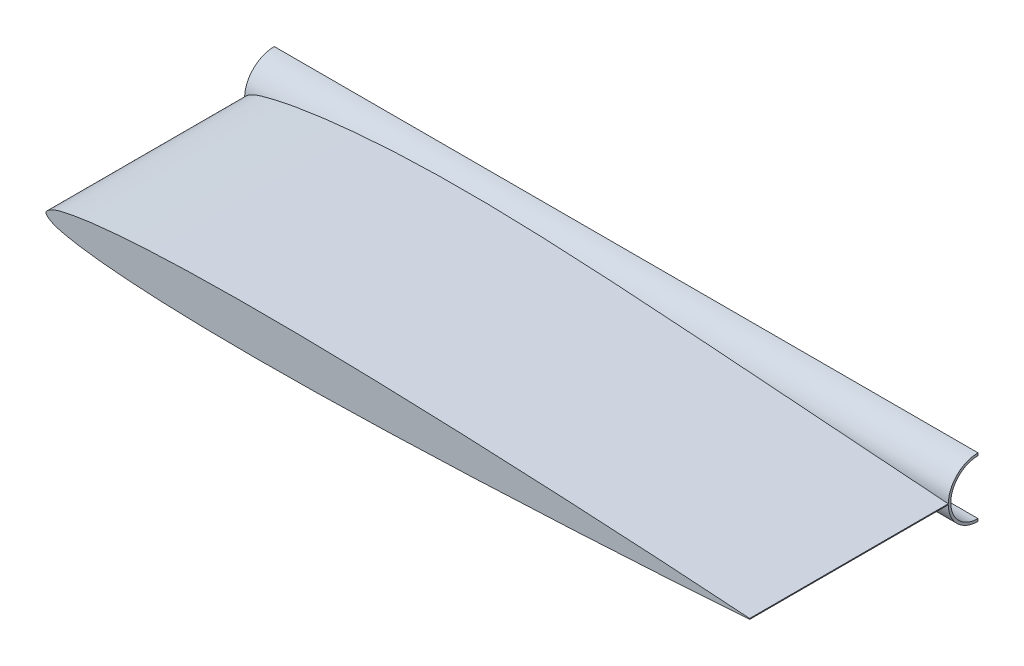
from build123d import *

# Parameters (mm, degrees)
BOSS_EXTRUDE1_DEPTH     = 185.42
BOSS_EXTRUDE2_DEPTH     = 571.5
CUT_EXTRUDE1_DEPTH      = 602.31113698
CUT_EXTRUDE1_DEPTH_BACK = 602.31113698


with BuildPart() as part:
    # Sketch1 → Boss-Extrude1 (new body)
    with BuildSketch(Plane.XY):
        with BuildLine():
            Line((571.5, 0.360045), (571.5, -0.360045))
            add(Edge.make_bspline(
                [(571.5, 0.360045), (561.975510313, 1.015387176), (542.928912588, 2.325907658), (504.832156781, 4.763026707), (457.21071903, 7.562220815), (400.059564076, 10.533161685), (342.90993238, 13.12154544), (285.759759849, 15.228011136), (228.608301613, 16.730224822), (180.976079252, 17.25488768), (142.872056015, 17.047281355), (114.293689392, 16.483213625), (85.700399103, 15.396241687), (61.902376846, 13.885403828), (42.809940554, 12.056855338), (28.619749674, 10.332819707), (16.251608431, 7.958404715), (7.184909393, 5.858143046), (-3.927293718, 0), (7.184909393, -5.858143046), (16.251608431, -7.958404715), (28.619749674, -10.332819707), (42.809940554, -12.056855338), (61.902376846, -13.885403828), (85.700399103, -15.396241687), (114.293689392, -16.483213625), (142.872056015, -17.047281355), (180.976079252, -17.25488768), (228.608301613, -16.730224822), (285.759759849, -15.228011136), (342.90993238, -13.12154544), (400.059564076, -10.533161686), (457.21071903, -7.562220816), (504.832156781, -4.763026707), (542.928912588, -2.325907658), (561.975510313, -1.015387177), (571.5, -0.360045)],
                knots=[0, 0, 0, 0, 0.024924558, 0.049842883, 0.099663048, 0.149464506, 0.199249099, 0.24901648, 0.298766909, 0.348503609, 0.373371188, 0.398243493, 0.423129723, 0.448051613, 0.460542817, 0.473079728, 0.485731111, 0.492200581, 0.5, 0.507799419, 0.514268889, 0.526920272, 0.539457183, 0.551948387, 0.576870277, 0.601756507, 0.626628812, 0.651496391, 0.701233091, 0.75098352, 0.800750901, 0.850535494, 0.900336952, 0.950157117, 0.975075442, 1, 1, 1, 1], degree=3))
        make_face()
    extrude(amount=BOSS_EXTRUDE1_DEPTH)

    # Sketch2 → Boss-Extrude2 (add)
    with BuildSketch(Plane(origin=(571.5, 0, 0), x_dir=(0, 0, -1), z_dir=(1, 0, 0))):
        with BuildLine():
            Line((0, -24.13), (0, 24.13))
            ThreePointArc((0, 24.13), (-24.13, 0), (0, -24.13))
        make_face()
    extrude(amount=-BOSS_EXTRUDE2_DEPTH)

    # Sketch3 → Cut-Extrude1 (cut, two sides: drawn at the far end of the back side and taken through both)
    with BuildSketch(Plane.ZY.offset(-CUT_EXTRUDE1_DEPTH_BACK)):
        with BuildLine():
            Line((0, 22.098), (0, -22.098))
            ThreePointArc((0, -22.098), (22.098, 0), (0, 22.098))
        make_face()
    extrude(amount=CUT_EXTRUDE1_DEPTH + CUT_EXTRUDE1_DEPTH_BACK, mode=Mode.SUBTRACT)


solid = part.part
